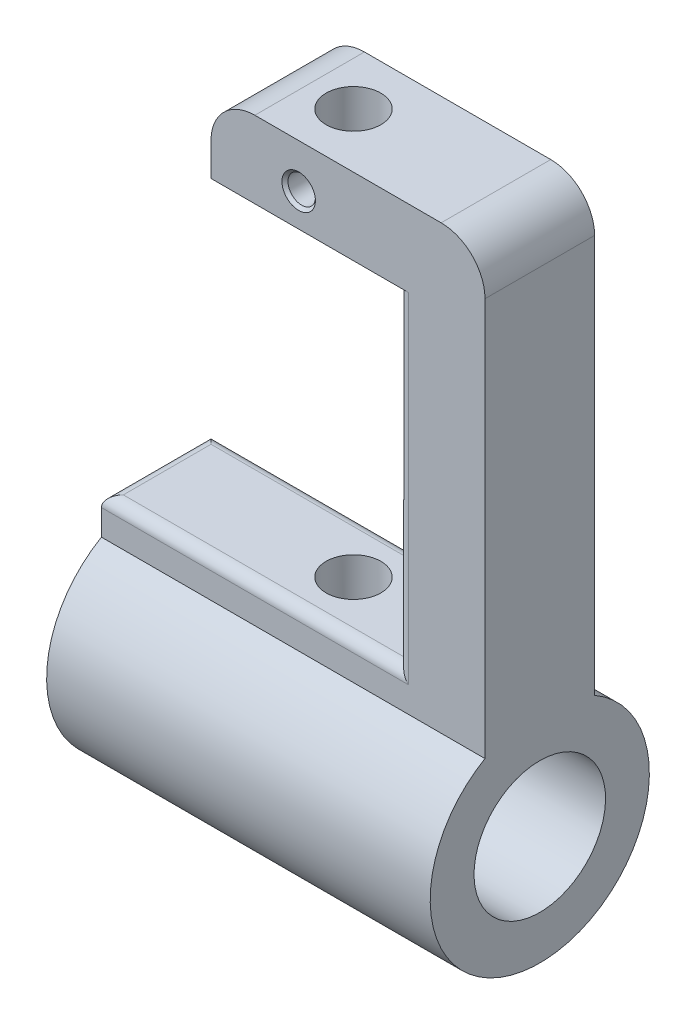
from build123d import *

# Parameters (mm, degrees)
EXTRUDE_1_DEPTH              = 10
SKETCH_5_R                   = 10
EXTRUDE_2_DEPTH              = 35
SKETCH_7_R                   = 6
CUT_EXTRUDE_1_DEPTH          = 59.949130613
SKETCH_8_R                   = 2.5
CUT_EXTRUDE_3_DEPTH          = 41
FILLET_3_R                   = 1
HOLE_WIZARD_M3_2_D           = 2.5
HOLE_WIZARD_M3_2_DEPTH       = 7
HOLE_WIZARD_M3_2_CSINK_D     = 3.05
HOLE_WIZARD_M3_2_CSINK_ANGLE = 90
HOLE_WIZARD_M3_2_TIP         = 0.751075774


with BuildPart() as part:
    # 草图1 → 凸台-拉伸1 (new body)
    with BuildSketch(Plane.XY):
        with BuildLine():
            Line((-8, 8), (-8, 38))
            Line((-8, 38), (-25, 38))
            Line((-25, 38), (-25, 41))
            ThreePointArc((-25, 41), (-23.828427125, 43.828427125), (-21, 45))
            Line((-21, 45), (-4, 45))
            ThreePointArc((-4, 45), (-1.171572875, 43.828427125), (0, 41))
            Line((0, 41), (0, 0))
            Line((0, 0), (-35, 0))
            Line((-35, 0), (-35, 8))
            Line((-35, 8), (-8, 8))
        make_face()
    extrude(amount=EXTRUDE_1_DEPTH)

    # 草图5 → 凸台-拉伸2 (add, through all)
    with BuildSketch(Plane(origin=(0, 0, 0), x_dir=(0, 0, -1), z_dir=(1, 0, 0))):
        with Locations((-5, -4)):
            Circle(SKETCH_5_R)
    extrude(amount=-EXTRUDE_2_DEPTH)

    # 草图7 → 切除-拉伸1 (cut, through all)
    with BuildSketch(Plane(origin=(0, 0, 0), x_dir=(0, 0, -1), z_dir=(1, 0, 0))):
        with Locations(Location((-5, -4, 0), (0, 0, 90))):
            Circle(SKETCH_7_R)
    extrude(amount=-CUT_EXTRUDE_1_DEPTH, mode=Mode.SUBTRACT)

    # 草图8 → 切除-拉伸3 (cut)
    with BuildSketch(Plane(origin=(0, 45, 0), x_dir=(1, 0, 0), z_dir=(0, 1, 0))):
        with Locations(Location((-17, -5, 0), (0, 0, 270))):
            Circle(SKETCH_8_R)
    extrude(amount=-CUT_EXTRUDE_3_DEPTH, mode=Mode.SUBTRACT)

    # 圆角3
    fillet_3_edges = [part.edges().sort_by_distance(p)[0] for p in [
        (-21.5, 8, 0),
        (-8, 23, 0),
        (-35, 8, 5),
        (-8, 23, 10),
        (-21.5, 8, 10),
    ]]
    fillet(fillet_3_edges, radius=FILLET_3_R)

    # M3 螺纹孔2
    with Locations(Plane(origin=(-17, 41, 10), x_dir=(1, 0, 0), z_dir=(0, 0, 1))):
        with Locations((0, 0)):
            CounterSinkHole(HOLE_WIZARD_M3_2_D / 2, HOLE_WIZARD_M3_2_CSINK_D / 2, depth=HOLE_WIZARD_M3_2_DEPTH, counter_sink_angle=HOLE_WIZARD_M3_2_CSINK_ANGLE)
            with Locations((0, 0, -(HOLE_WIZARD_M3_2_DEPTH + HOLE_WIZARD_M3_2_TIP / 2))):  # 118° drill point
                Cone(0, HOLE_WIZARD_M3_2_D / 2, HOLE_WIZARD_M3_2_TIP, mode=Mode.SUBTRACT)


solid = part.part
